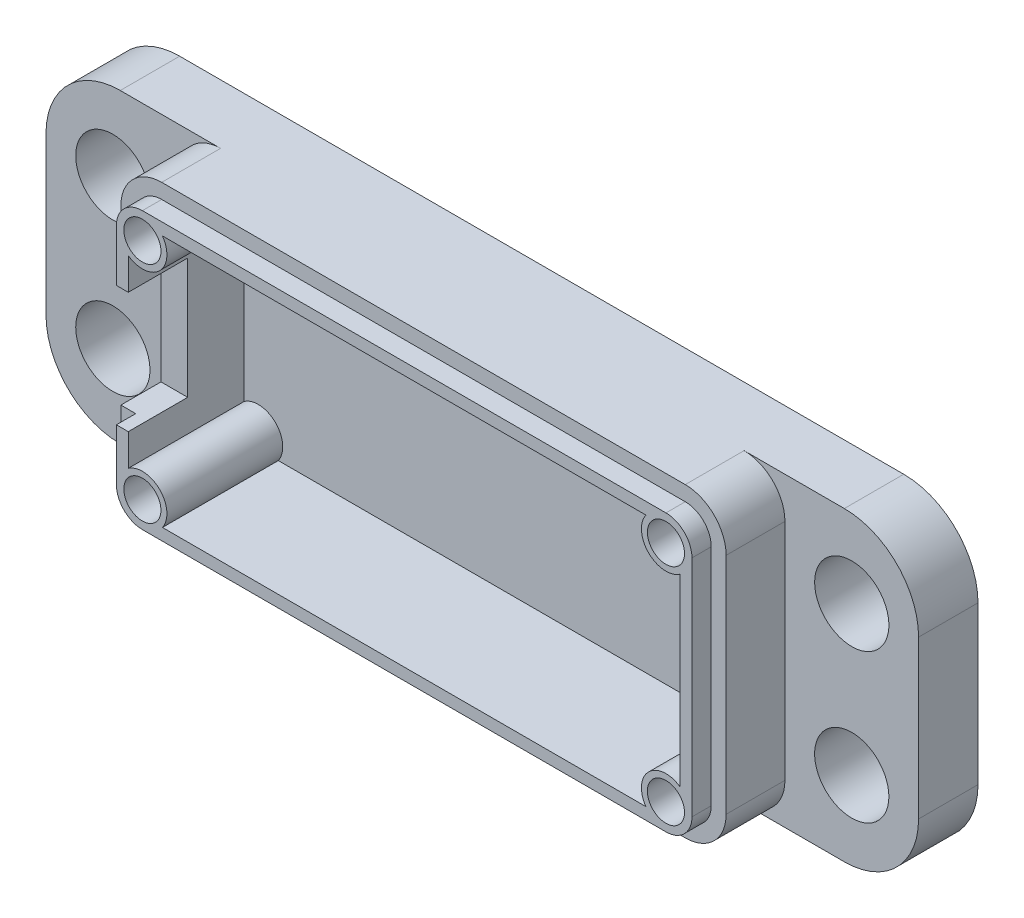
from build123d import *

# Parameters (mm, degrees)
ESQUISSE1_W         = 40.75
ESQUISSE1_H         = 20.6
EXTRUSION1_DEPTH    = 9.26
ESQUISSE2_R         = 1.25
EXTRUSION2_DEPTH    = 47.590450738
ESQUISSE4_OUTSIDE_W = 52.068
ESQUISSE4_OUTSIDE_H = 31.918
EXTRUSION5_DEPTH    = 47.590450738
EXTRUSION4_START    = -1.3
EXTRUSION4_DEPTH    = 1.3
EXTRUSION9_DEPTH    = 7.8
EXTRUSION10_REACH   = 48.59
ESQUISSE7_W         = 4
ESQUISSE7_H         = 8.124058542
ESQUISSE8_R         = 2.5
EXTRUSION11_DEPTH   = 4
CONG_1_R            = 5
ESQUISSE9_R         = 2.1
EXTRUSION12_DEPTH   = 1.3


with BuildPart() as part:
    # Esquisse1 → Extrusion1 (new body)
    with BuildSketch(Plane.XY):
        with Locations((-20.375, 10.3)):
            Rectangle(ESQUISSE1_W, ESQUISSE1_H)
    extrude(amount=EXTRUSION1_DEPTH)

    # Esquisse2 → Extrusion2 (cut, through all)
    with BuildSketch(Plane.XY.offset(9.26)):
        with Locations((-38, 17.85)):
            Circle(ESQUISSE2_R)
        with Locations(Location((-38, 2.75, 0), (0, 0, 180))):
            Circle(ESQUISSE2_R)
        with Locations((-2.75, 2.75)):
            Circle(ESQUISSE2_R)
        with Locations(Location((-2.75, 17.85, 0), (0, 0, 180))):
            Circle(ESQUISSE2_R)
    extrude(amount=-EXTRUSION2_DEPTH, mode=Mode.SUBTRACT)

    # Esquisse4 outside → Extrusion5 (cut, through all)
    with BuildSketch(Plane(origin=(0, 0, 0), x_dir=(-1, 0, 0), z_dir=(0, 0, -1))):
        with Locations((20.375, 10.3)):
            Rectangle(ESQUISSE4_OUTSIDE_W, ESQUISSE4_OUTSIDE_H)
        with BuildLine():
            Line((2.75, 20.6), (38, 20.6))
            ThreePointArc((38, 20.6), (39.944543648, 19.794543648), (40.75, 17.85))
            Line((40.75, 17.85), (40.75, 2.75))
            ThreePointArc((40.75, 2.75), (39.944543648, 0.805456352), (38, 0))
            Line((38, 0), (2.75, 0))
            ThreePointArc((2.75, 0), (0.805456352, 0.805456352), (0, 2.75))
            Line((0, 2.75), (0, 17.85))
            ThreePointArc((0, 17.85), (0.805456352, 19.794543648), (2.75, 20.6))
        make_face(mode=Mode.SUBTRACT)
    extrude(amount=-EXTRUSION5_DEPTH, mode=Mode.SUBTRACT)

    # Esquisse3 → Extrusion4 (cut)
    with BuildSketch(Plane.XY.offset(9.26).offset(EXTRUSION4_START)):
        with BuildLine():
            Line((-38, 20.6), (-2.75, 20.6))
            ThreePointArc((-2.75, 20.6), (-0.805456352, 19.794543648), (0, 17.85))
            Line((0, 17.85), (0, 2.75))
            ThreePointArc((0, 2.75), (-0.805456352, 0.805456352), (-2.75, 0))
            Line((-2.75, 0), (-38, 0))
            ThreePointArc((-38, 0), (-39.944543648, 0.805456352), (-40.75, 2.75))
            Line((-40.75, 2.75), (-40.75, 17.85))
            ThreePointArc((-40.75, 17.85), (-39.944543648, 19.794543648), (-38, 20.6))
        make_face()
        with BuildLine():
            Line((-38, 19.6), (-2.75, 19.6))
            ThreePointArc((-2.75, 19.6), (-1.512563133, 19.087436867), (-1, 17.85))
            Line((-1, 17.85), (-1, 2.75))
            ThreePointArc((-1, 2.75), (-1.512563133, 1.512563133), (-2.75, 1))
            Line((-2.75, 1), (-38, 1))
            ThreePointArc((-38, 1), (-39.237436867, 1.512563133), (-39.75, 2.75))
            Line((-39.75, 2.75), (-39.75, 17.85))
            ThreePointArc((-39.75, 17.85), (-39.237436867, 19.087436867), (-38, 19.6))
        make_face(mode=Mode.SUBTRACT)
    extrude(amount=EXTRUSION4_DEPTH, mode=Mode.SUBTRACT)

    # Esquisse6 → Extrusion9 (cut)
    with BuildSketch(Plane.XY.offset(9.26)):
        with BuildLine():
            Line((-36.650926244, 18.8), (-4.099073756, 18.8))
            ThreePointArc((-4.099073756, 18.8), (-3.916726189, 16.683273811), (-1.8, 16.500926244))
            Line((-1.8, 16.500926244), (-1.8, 4.099073756))
            ThreePointArc((-1.8, 4.099073756), (-3.916726189, 3.916726189), (-4.099073756, 1.8))
            Line((-4.099073756, 1.8), (-36.650926244, 1.8))
            ThreePointArc((-36.650926244, 1.8), (-36.833273811, 3.916726189), (-38.95, 4.099073756))
            Line((-38.95, 4.099073756), (-38.95, 16.500926244))
            ThreePointArc((-38.95, 16.500926244), (-36.833273811, 16.683273811), (-36.650926244, 18.8))
        make_face()
    extrude(amount=-EXTRUSION9_DEPTH, mode=Mode.SUBTRACT)

    # Extrusion10: up to this face of the body (flat: up to its plane)
    extrusion10_end = Plane(part.part.faces().sort_by_distance((-38.95, 10.3, 5.36))[0])
    # Esquisse7 → Extrusion10 (cut, up to the picked face)
    with BuildSketch(Plane.ZY.offset(40.75), mode=Mode.PRIVATE) as extrusion10_sk1:
        with Locations((7.26, 10.3)):
            Rectangle(ESQUISSE7_W, ESQUISSE7_H)
    extrusion10_tool1 = split(extrude(extrusion10_sk1.sketch, amount=-EXTRUSION10_REACH, mode=Mode.PRIVATE), bisect_by=extrusion10_end, keep=Keep.BOTH, mode=Mode.PRIVATE)
    add(extrusion10_tool1.solids().sort_by(Axis((-40.75, 10.3, 7.26), (1, 0, 0)))[0], mode=Mode.SUBTRACT)

    # Esquisse8 → Extrusion11 (add)
    # profile 1 of 2: a face of its own
    with BuildSketch(Plane(origin=(0, 0, 0), x_dir=(-1, 0, 0), z_dir=(0, 0, -1))):
        with BuildLine():
            Line((-9, 20.6), (2.75, 20.6))
            ThreePointArc((2.75, 20.6), (0.805456352, 19.794543648), (0, 17.85))
            Line((0, 17.85), (0, 2.75))
            ThreePointArc((0, 2.75), (0.805456352, 0.805456352), (2.75, 0))
            Line((2.75, 0), (-9, 0))
            Line((-9, 0), (-9, 20.6))
        make_face()
        with Locations((-4.5, 15.3)):
            Circle(ESQUISSE8_R, mode=Mode.SUBTRACT)
        with Locations(Location((-4.5, 5.3, 0), (0, 0, 180))):
            Circle(ESQUISSE8_R, mode=Mode.SUBTRACT)
    # profile 2 of 2: a face of its own
    with BuildSketch(Plane(origin=(0, 0, 0), x_dir=(-1, 0, 0), z_dir=(0, 0, -1))):
        with BuildLine():
            Line((49.75, 0), (38, 0))
            ThreePointArc((38, 0), (39.944543648, 0.805456352), (40.75, 2.75))
            Line((40.75, 2.75), (40.75, 17.85))
            ThreePointArc((40.75, 17.85), (39.944543648, 19.794543648), (38, 20.6))
            Line((38, 20.6), (49.75, 20.6))
            Line((49.75, 20.6), (49.75, 0))
        make_face()
        with Locations((45.25, 5.3)):
            Circle(ESQUISSE8_R, mode=Mode.SUBTRACT)
        with Locations(Location((45.25, 15.3, 0), (0, 0, 180))):
            Circle(ESQUISSE8_R, mode=Mode.SUBTRACT)
    extrude(amount=-EXTRUSION11_DEPTH)

    # Congé1
    cong_1_edges = [part.edges().sort_by_distance(p)[0] for p in [
        (9, 0, 2),
        (9, 20.6, 2),
        (-49.75, 20.6, 2),
        (-49.75, 0, 2),
    ]]
    fillet(cong_1_edges, radius=CONG_1_R)

    # Esquisse9 → Extrusion12 (cut)
    with BuildSketch(Plane(origin=(0, 0, 0), x_dir=(-1, 0, 0), z_dir=(0, 0, -1))):
        with Locations((2.75, 17.85)):
            Circle(ESQUISSE9_R)
        with Locations((38, 17.85)):
            Circle(ESQUISSE9_R)
        with Locations((38, 2.75)):
            Circle(ESQUISSE9_R)
        with Locations((2.75, 2.75)):
            Circle(ESQUISSE9_R)
    extrude(amount=-EXTRUSION12_DEPTH, mode=Mode.SUBTRACT)


solid = part.part
